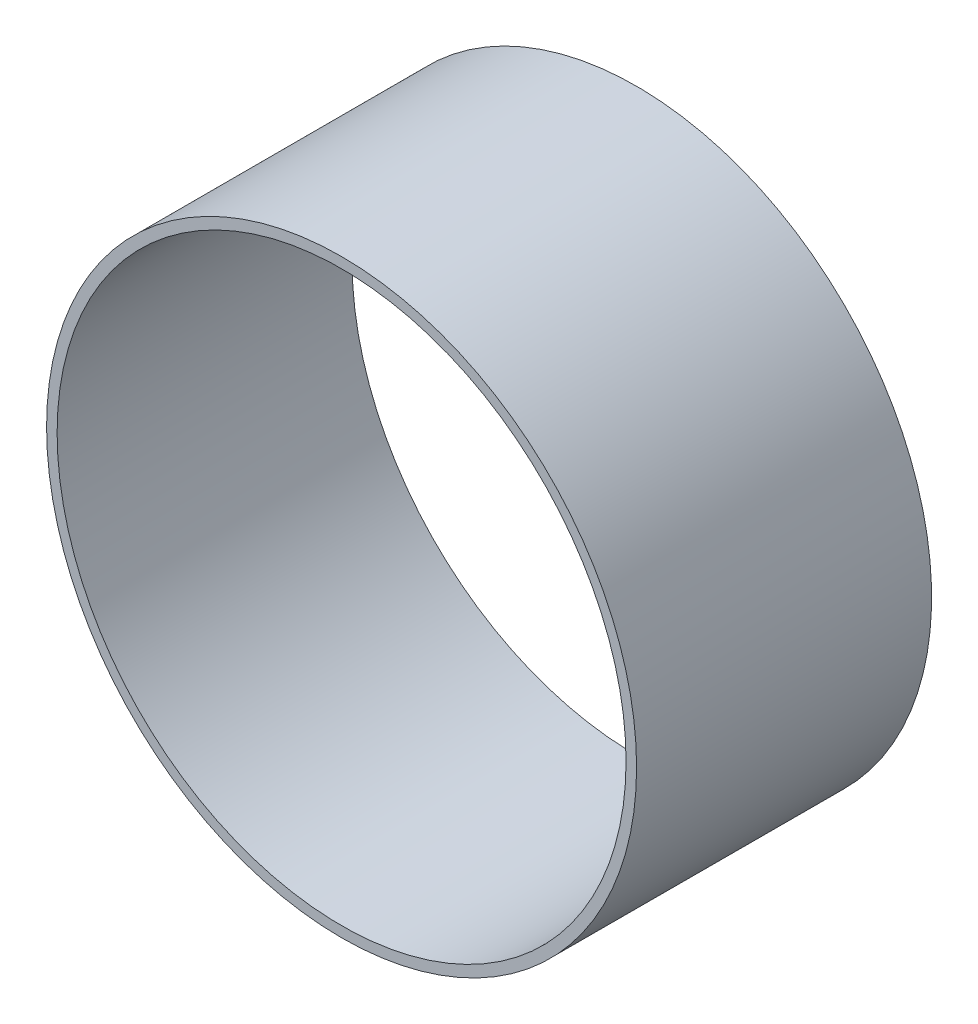
from build123d import *

# Parameters (mm, degrees)
SKETCH1_R           = 14
SKETCH1_R_2         = 13.5
BOSS_EXTRUDE1_DEPTH = 19
SKETCH2_R           = 22.693972539
SKETCH2_R_2         = 8.205109265
CUT_EXTRUDE1_DEPTH  = 5


with BuildPart() as part:
    # Sketch1 → Boss-Extrude1 (new body)
    with BuildSketch(Plane.XY):
        Circle(SKETCH1_R)
        Circle(SKETCH1_R_2, mode=Mode.SUBTRACT)
    extrude(amount=BOSS_EXTRUDE1_DEPTH)

    # Sketch2 → Cut-Extrude1 (cut)
    with BuildSketch(Plane(origin=(0, 0, 0), x_dir=(-1, 0, 0), z_dir=(0, 0, -1))):
        Circle(SKETCH2_R)
        Circle(SKETCH2_R_2, mode=Mode.SUBTRACT)
    extrude(amount=-CUT_EXTRUDE1_DEPTH, mode=Mode.SUBTRACT)


solid = part.part
